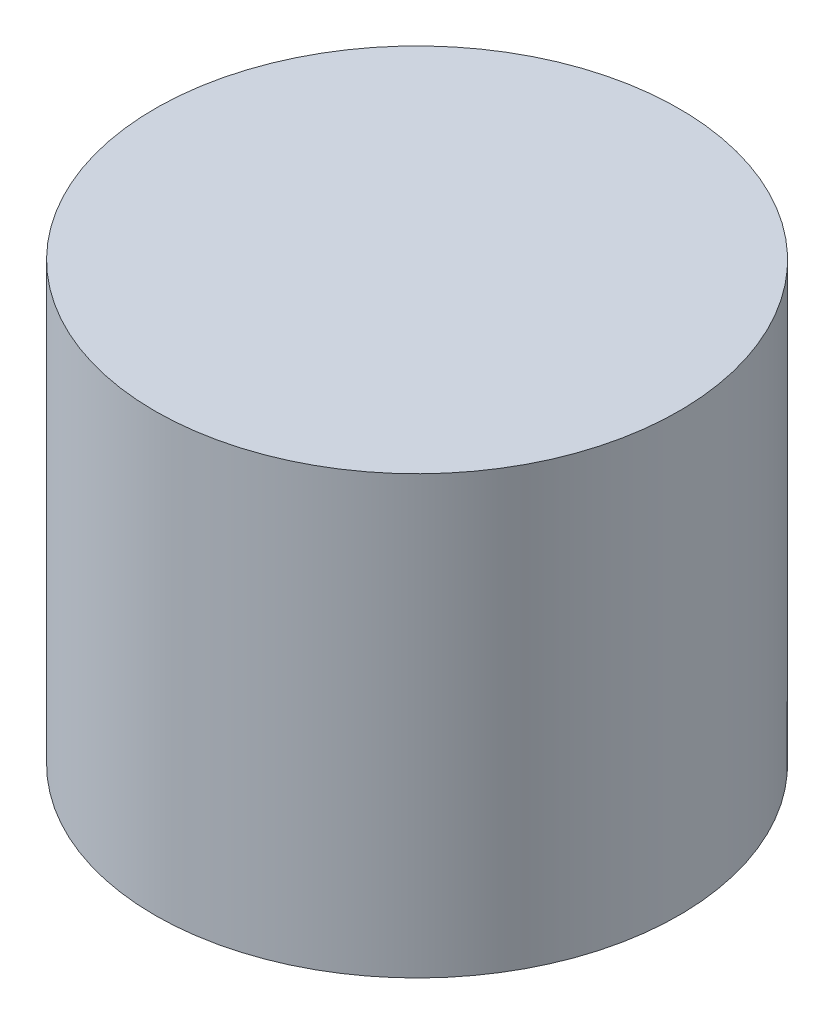
from build123d import *

# Parameters (mm, degrees)
SKETCH1_R           = 6
BOSS_EXTRUDE1_DEPTH = 10


with BuildPart() as part:
    # Sketch1 → Boss-Extrude1 (new body)
    with BuildSketch(Plane(origin=(0, 0, 0), x_dir=(1, 0, 0), z_dir=(0, 1, 0))):
        with Locations(Location((0, 0, 0), (0, 0, 270))):
            Circle(SKETCH1_R)
    extrude(amount=BOSS_EXTRUDE1_DEPTH)


solid = part.part
